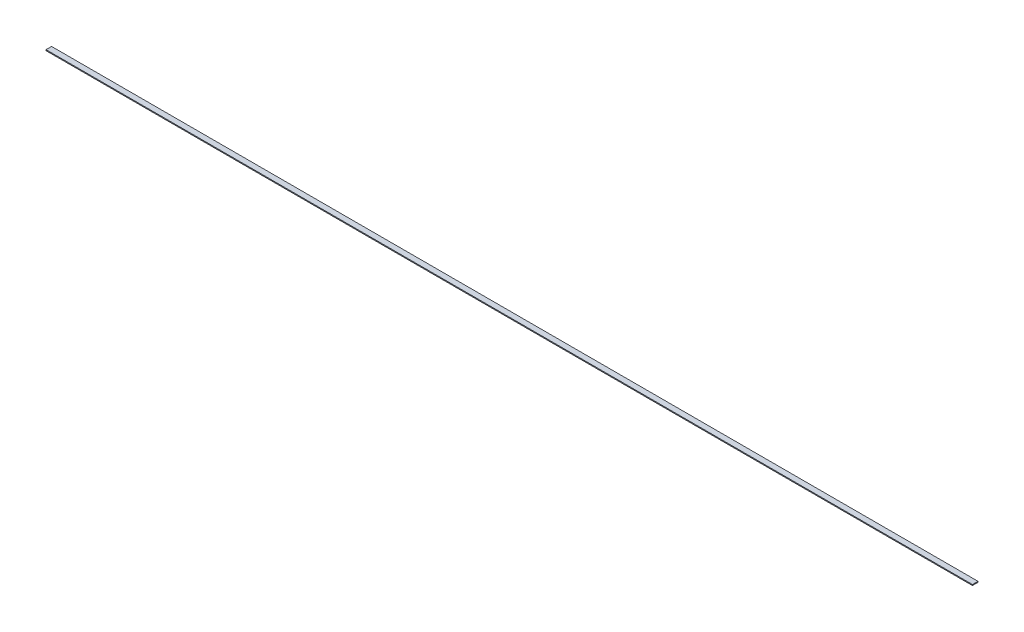
from build123d import *

# Parameters (mm, degrees)
SKETCH1_W           = 1000
SKETCH1_H           = 1
BOSS_EXTRUDE1_DEPTH = 6


with BuildPart() as part:
    # Sketch1 → Boss-Extrude1 (new body)
    with BuildSketch(Plane.XY):
        with Locations((500, 0.5)):
            Rectangle(SKETCH1_W, SKETCH1_H)
    extrude(amount=BOSS_EXTRUDE1_DEPTH)


solid = part.part
